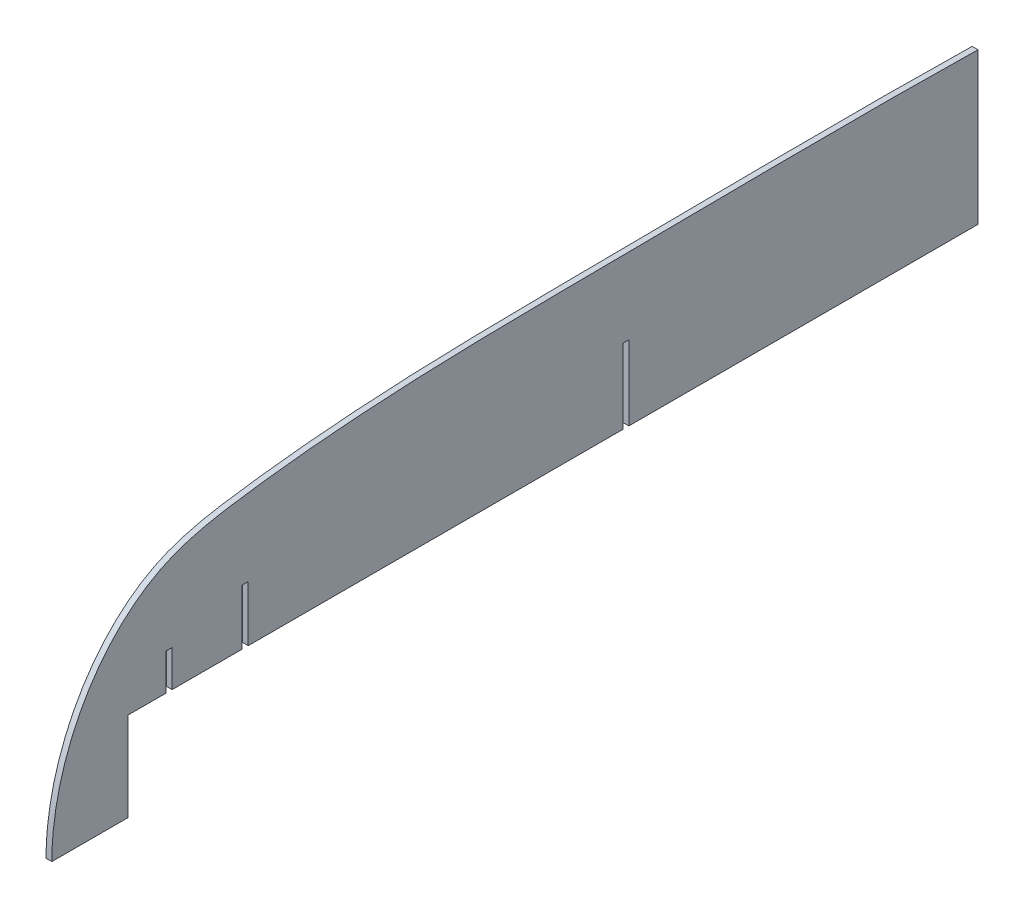
from build123d import *

# Parameters (mm, degrees)
BOSS_EXTRUDE1_DEPTH = 2.921
CUT_EXTRUDE1_DEPTH  = 1488.311355111


with BuildPart() as part:
    # Sketch3 → Boss-Extrude1 (new, symmetric)
    with BuildSketch(Plane(origin=(0, 0, 0), x_dir=(0, 0, -1), z_dir=(1, 0, 0))):
        with BuildLine():
            Line((-1460.5, 39.6875), (381, 39.6875))
            add(Edge.make_bspline(
                [(-1460.5, 39.6875), (-1460.5, 123.854582151), (-1400.448958782, 238.643618873), (-1168.264534851, 278.653196971), (-889.863220578, 278.192638574), (-549.517003244, 284.069445788), (-254.872972463, 268.16247247), (-19.653982034, 247.753440535), (192.838300002, 207.087014824), (381, 130.986638489), (381, 39.6875)],
                knots=[0, 0, 0, 0, 0.114447643, 0.153235008, 0.341616396, 0.529762749, 0.655350341, 0.781406837, 0.871201698, 1, 1, 1, 1], degree=3))
        make_face()
    extrude(amount=BOSS_EXTRUDE1_DEPTH, both=True)

    # Sketch5 → Cut-Extrude1 (cut, through all)
    with BuildSketch(Plane(origin=(2.921, 0, 0), x_dir=(0, 0, -1), z_dir=(1, 0, 0))):
        Polygon((-1384.3, 39.6875), (545.915550589, 39.6875), (545.915550589, 328.856345879), (-533.4, 328.856345879), (-533.4, 128.5875), (-882.904, 128.5875), (-882.904, 203.2), (-889, 203.2), (-889, 128.5875), (-1263.904, 128.5875), (-1263.904, 184.15), (-1270, 184.15), (-1270, 128.5875), (-1340.104, 128.5875), (-1340.104, 165.1), (-1346.2, 165.1), (-1346.2, 128.5875), (-1384.3, 128.5875), align=None)
    extrude(amount=-CUT_EXTRUDE1_DEPTH, mode=Mode.SUBTRACT)


solid = part.part
